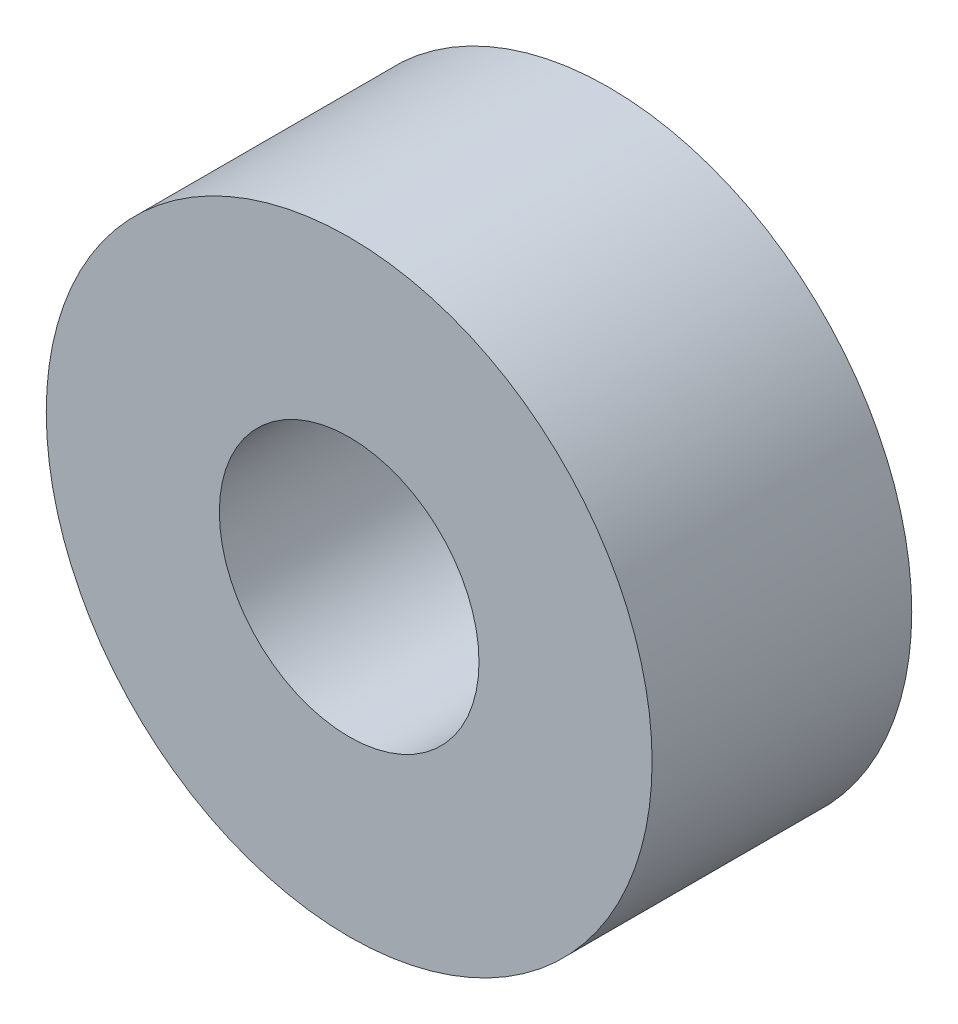
from build123d import *

# Parameters (mm, degrees)
SCHIZZO1_R                   = 35
SCHIZZO1_R_2                 = 15
ESTRUSIONE_ESTRUSIONE1_DEPTH = 30


with BuildPart() as part:
    # Schizzo1 → Estrusione-Estrusione1 (new body)
    with BuildSketch(Plane.XY):
        Circle(SCHIZZO1_R)
        Circle(SCHIZZO1_R_2, mode=Mode.SUBTRACT)
    extrude(amount=ESTRUSIONE_ESTRUSIONE1_DEPTH)


solid = part.part
